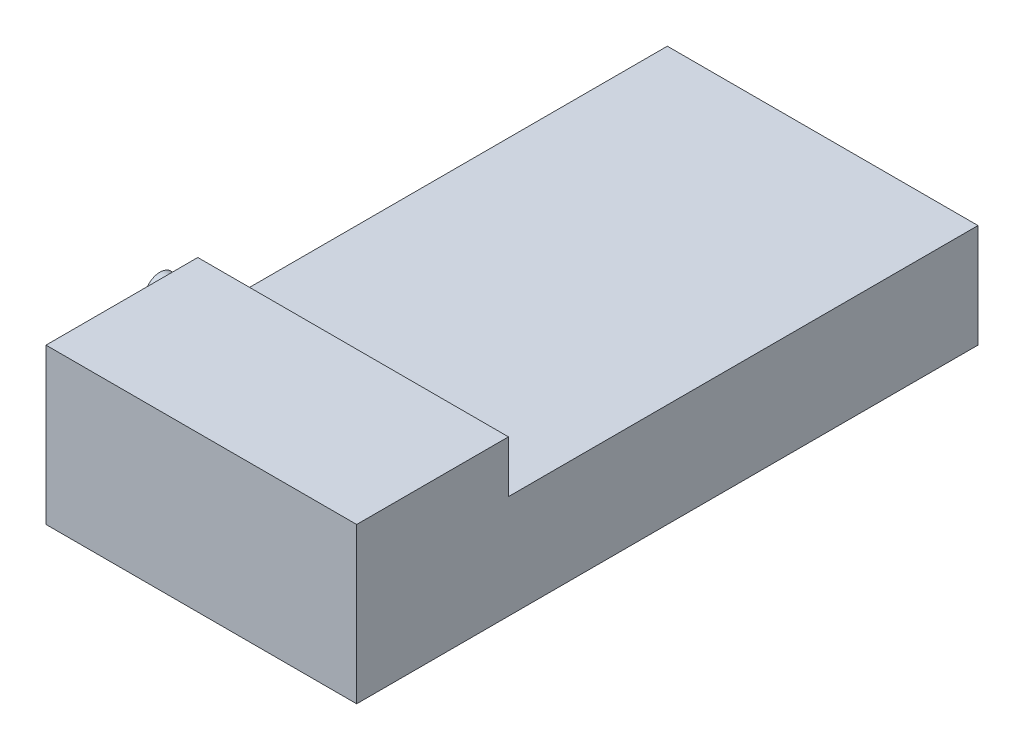
from build123d import *

# Parameters (mm, degrees)
SKETCH2_W           = 38.1
SKETCH2_H           = 76.2
BOSS_EXTRUDE1_DEPTH = 12.7
SKETCH3_R           = 1.905
BOSS_EXTRUDE3_DEPTH = 11.43
SKETCH5_W           = 38.1
SKETCH5_H           = 18.614666354
BOSS_EXTRUDE5_DEPTH = 2.54
SKETCH6_W           = 38.1
SKETCH6_H           = 18.614666354
BOSS_EXTRUDE6_DEPTH = 3.81


with BuildPart() as part:
    # Sketch2 → Boss-Extrude1 (new body)
    with BuildSketch(Plane(origin=(0, 0, 0), x_dir=(1, 0, 0), z_dir=(0, 1, 0))):
        with Locations((19.05, 38.1)):
            Rectangle(SKETCH2_W, SKETCH2_H)
    extrude(amount=BOSS_EXTRUDE1_DEPTH)

    # Sketch3 → Boss-Extrude3 (add)
    with BuildSketch(Plane.ZY):
        with Locations(Location((-25.4, 6.478602977, 0), (0, 0, 180))):
            Circle(SKETCH3_R)
    extrude(amount=BOSS_EXTRUDE3_DEPTH)

    # Sketch5 → Boss-Extrude5 (add)
    with BuildSketch(Plane(origin=(0, 12.7, 0), x_dir=(1, 0, 0), z_dir=(0, 1, 0))):
        with Locations((19.05, 9.307333177)):
            Rectangle(SKETCH5_W, SKETCH5_H)
    extrude(amount=BOSS_EXTRUDE5_DEPTH)

    # Sketch6 → Boss-Extrude6 (add)
    with BuildSketch(Plane(origin=(0, 15.24, 0), x_dir=(1, 0, 0), z_dir=(0, 1, 0))):
        with Locations((19.05, 9.307333177)):
            Rectangle(SKETCH6_W, SKETCH6_H)
    extrude(amount=BOSS_EXTRUDE6_DEPTH)


solid = part.part
